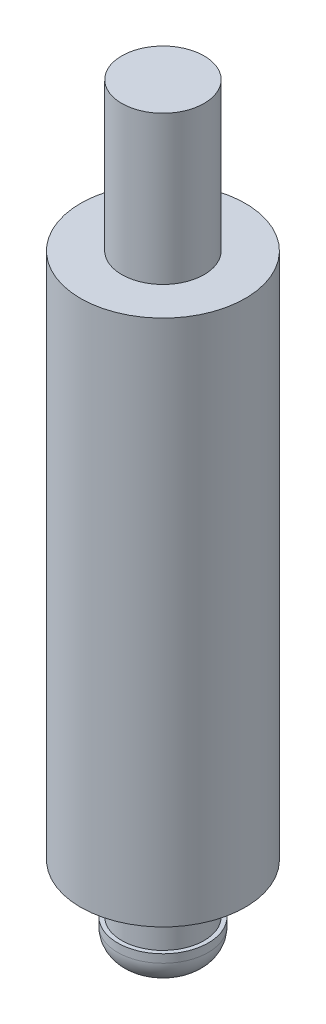
from build123d import *

# Parameters (mm, degrees)
SKETCH1_R           = 2.5
BOSS_EXTRUDE1_DEPTH = 16
SKETCH2_R           = 1.25
BOSS_EXTRUDE2_DEPTH = 4.5
BOSS_EXTRUDE3_START = 1.5
SKETCH3_R           = 1.25
BOSS_EXTRUDE3_DEPTH = 1.5
SKETCH4_R           = 1.375
BOSS_EXTRUDE4_DEPTH = 1
FILLET1_R           = 0.75


with BuildPart() as part:
    # Sketch1 → Boss-Extrude1 (new body)
    with BuildSketch(Plane(origin=(0, 0, 0), x_dir=(1, 0, 0), z_dir=(0, 1, 0))):
        with Locations(Location((0, 0, 0), (0, 0, 270))):
            Circle(SKETCH1_R)
    extrude(amount=BOSS_EXTRUDE1_DEPTH)

    # Sketch2 → Boss-Extrude2 (add)
    with BuildSketch(Plane(origin=(0, 16, 0), x_dir=(1, 0, 0), z_dir=(0, 1, 0))):
        with Locations(Location((0, 0, 0), (0, 0, 270))):
            Circle(SKETCH2_R)
    extrude(amount=BOSS_EXTRUDE2_DEPTH)

    # Sketch3 → Boss-Extrude3 (add)
    with BuildSketch(Plane(origin=(0, 0, 0), x_dir=(-1, 0, 0), z_dir=(0, -1, 0)).offset(BOSS_EXTRUDE3_START)):
        with Locations(Location((0, 0, 0), (0, 0, 270))):
            Circle(SKETCH3_R)
    extrude(amount=-BOSS_EXTRUDE3_DEPTH)

    # Sketch4 → Boss-Extrude4 (add)
    with BuildSketch(Plane(origin=(0, -1.5, 0), x_dir=(-1, 0, 0), z_dir=(0, -1, 0))):
        with Locations(Location((0, 0, 0), (0, 0, 90))):
            Circle(SKETCH4_R)
    extrude(amount=BOSS_EXTRUDE4_DEPTH)

    # Fillet1
    fillet1_edges = [part.edges().sort_by_distance(p)[0] for p in [
        (0, -2.5, 1.375),
    ]]
    fillet(fillet1_edges, radius=FILLET1_R)


solid = part.part
